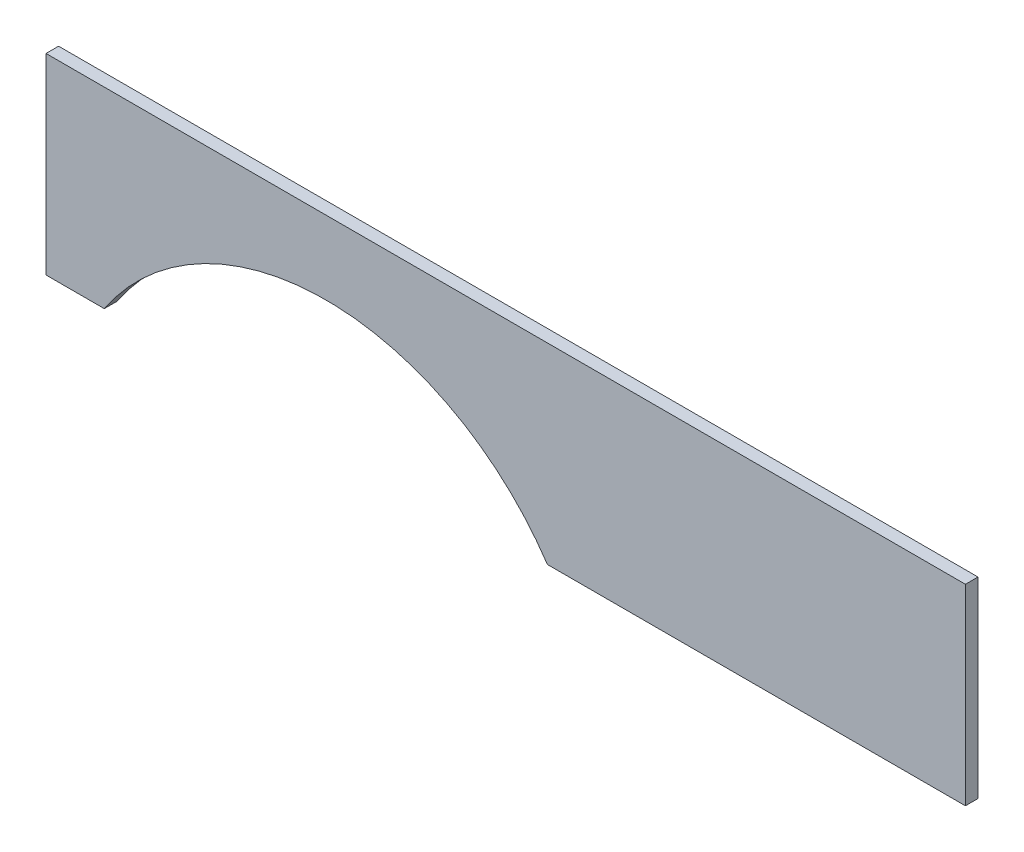
from build123d import *

# Parameters (mm, degrees)
SKETCH1_W               = 219.075
SKETCH1_H               = 45.72
BOSS_EXTRUDE1_DEPTH     = 3
CUT_EXTRUDE1_DEPTH      = 224.815044233
CUT_EXTRUDE1_DEPTH_BACK = 224.815044233
SKETCH2_R               = 63.5


with BuildPart() as part:
    # Sketch1 → Boss-Extrude1 (new body)
    with BuildSketch(Plane.XY):
        with Locations((109.5375, 22.86)):
            Rectangle(SKETCH1_W, SKETCH1_H)
    extrude(amount=BOSS_EXTRUDE1_DEPTH)

    # Sketch2 → Cut-Extrude1 (cut, two sides: drawn at the far end of the back side and taken through both)
    with BuildSketch(Plane.XY.offset(3).offset(-CUT_EXTRUDE1_DEPTH_BACK)):
        with Locations((66.68, -35.29)):
            Circle(SKETCH2_R)
    extrude(amount=CUT_EXTRUDE1_DEPTH + CUT_EXTRUDE1_DEPTH_BACK, mode=Mode.SUBTRACT)


solid = part.part
